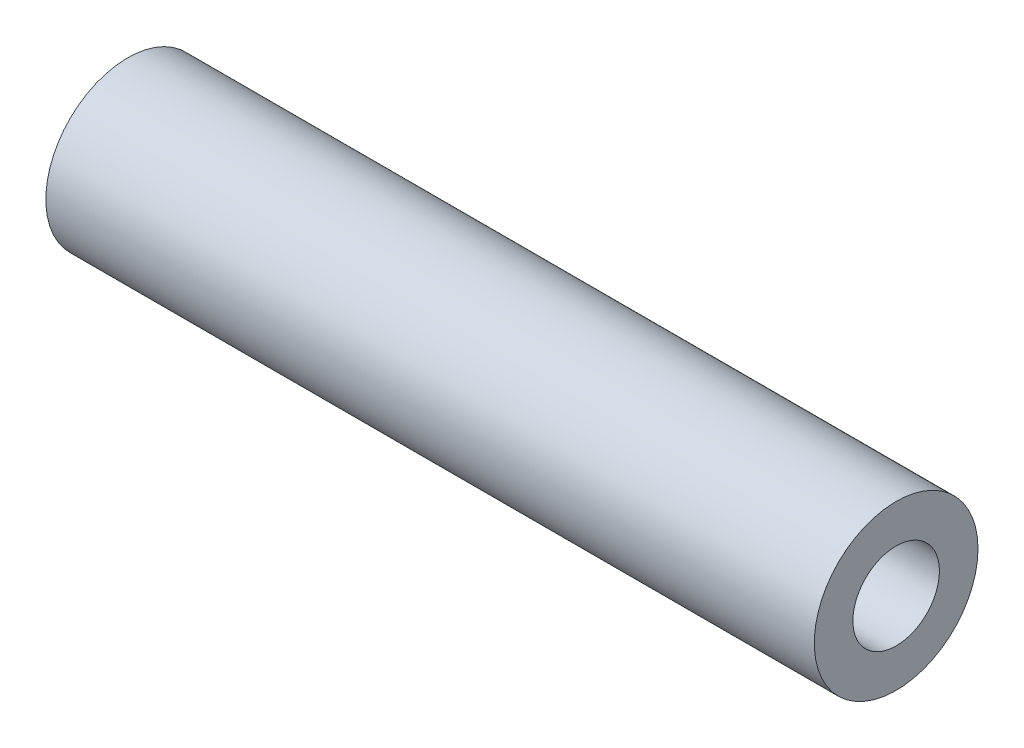
from build123d import *

# Parameters (mm, degrees)
SKETCH1_R           = 3.0861
SKETCH1_R_2         = 1.63195
BOSS_EXTRUDE1_DEPTH = 28.9687


with BuildPart() as part:
    # Sketch1 → Boss-Extrude1 (new body)
    with BuildSketch(Plane(origin=(0, 0, 0), x_dir=(0, 0, -1), z_dir=(1, 0, 0))):
        Circle(SKETCH1_R)
        Circle(SKETCH1_R_2, mode=Mode.SUBTRACT)
    extrude(amount=BOSS_EXTRUDE1_DEPTH)


solid = part.part
